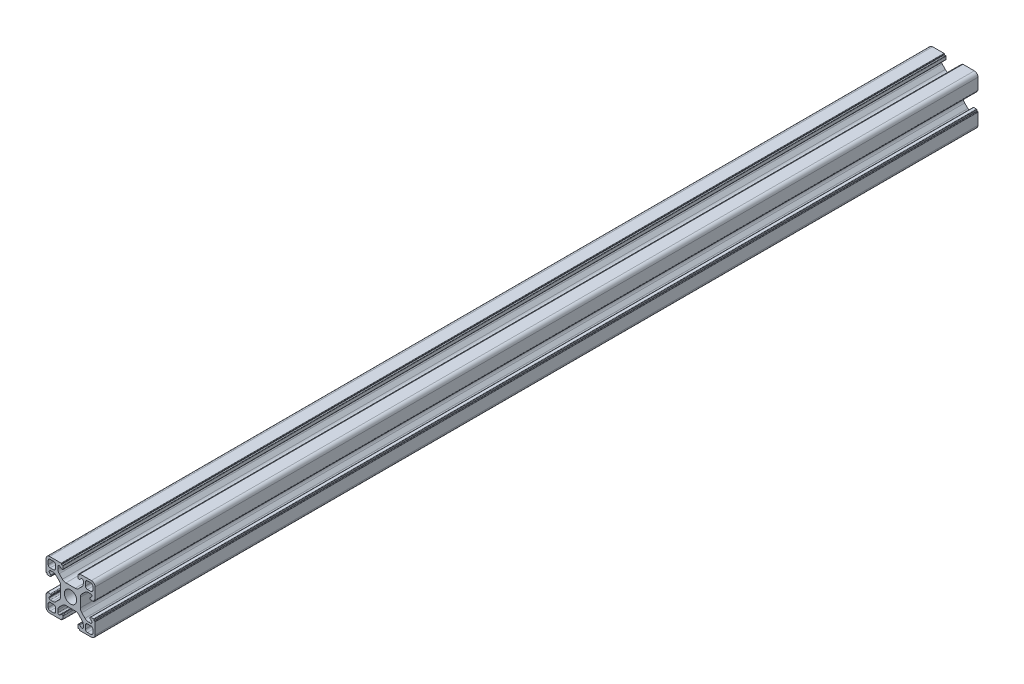
from build123d import *

# Parameters (mm, degrees)
EXTRUDE_1_DEPTH = 360


with BuildPart() as part:
    # Эскиз1 → Бобышка-Вытянуть1 (new body)
    with BuildSketch(Plane.XY):
        with BuildLine():
            Line((-31.105150957, 65.209647948), (-29.206370287, 65.209647948))
            ThreePointArc((-29.206370287, 65.209647948), (-28.441003423, 65.361888883), (-27.792156725, 65.795434385))
            Line((-27.792156725, 65.795434385), (-26.490937394, 67.096653716))
            ThreePointArc((-26.490937394, 67.096653716), (-26.057391892, 67.745500414), (-25.905150957, 68.510867279))
            Line((-25.905150957, 68.510867279), (-25.905150957, 69.409647948))
            ThreePointArc((-25.905150957, 69.409647948), (-26.051597566, 69.763201338), (-26.405150957, 69.909647948))
            Line((-26.405150957, 69.909647948), (-26.508044175, 69.909647948))
            ThreePointArc((-26.508044175, 69.909647948), (-26.699385892, 69.871587714), (-26.861597566, 69.763201338))
            Line((-26.861597566, 69.763201338), (-27.341927652, 69.282871252))
            ThreePointArc((-27.341927652, 69.282871252), (-27.423033489, 69.228678065), (-27.518704347, 69.209647948))
            Line((-27.518704347, 69.209647948), (-27.805150957, 69.209647948))
            ThreePointArc((-27.805150957, 69.209647948), (-27.981927652, 69.282871252), (-28.055150957, 69.459647948))
            Line((-28.055150957, 69.459647948), (-28.055150957, 70.608718768))
            ThreePointArc((-28.055150957, 70.608718768), (-28.011216974, 70.714784785), (-27.905150957, 70.758718768))
            Line((-27.905150957, 70.758718768), (-27.405150957, 70.758718768))
            Line((-27.405150957, 70.758718768), (-27.405150957, 71.059647948))
            ThreePointArc((-27.405150957, 71.059647948), (-27.361216974, 71.165713965), (-27.255150957, 71.209647948))
            Line((-27.255150957, 71.209647948), (-22.605150957, 71.209647948))
            ThreePointArc((-22.605150957, 71.209647948), (-21.544490785, 70.770308119), (-21.105150957, 69.709647948))
            Line((-21.105150957, 69.709647948), (-21.105150957, 65.059647948))
            ThreePointArc((-21.105150957, 65.059647948), (-21.149084939, 64.953581931), (-21.255150957, 64.909647948))
            Line((-21.255150957, 64.909647948), (-21.556080136, 64.909647948))
            Line((-21.556080136, 64.909647948), (-21.556080136, 64.409647948))
            ThreePointArc((-21.556080136, 64.409647948), (-21.600014119, 64.303581931), (-21.706080136, 64.259647948))
            Line((-21.706080136, 64.259647948), (-22.855150957, 64.259647948))
            ThreePointArc((-22.855150957, 64.259647948), (-23.031927652, 64.332871252), (-23.105150957, 64.509647948))
            Line((-23.105150957, 64.509647948), (-23.105150957, 64.796094557))
            ThreePointArc((-23.105150957, 64.796094557), (-23.08612084, 64.891765415), (-23.031927652, 64.972871252))
            Line((-23.031927652, 64.972871252), (-22.551597566, 65.453201338))
            ThreePointArc((-22.551597566, 65.453201338), (-22.44321119, 65.615413013), (-22.405150957, 65.806754729))
            Line((-22.405150957, 65.806754729), (-22.405150957, 65.909647948))
            ThreePointArc((-22.405150957, 65.909647948), (-22.551597566, 66.263201338), (-22.905150957, 66.409647948))
            Line((-22.905150957, 66.409647948), (-23.803931626, 66.409647948))
            ThreePointArc((-23.803931626, 66.409647948), (-24.56929849, 66.257407013), (-25.218145188, 65.82386151))
            Line((-25.218145188, 65.82386151), (-26.519364519, 64.522642179))
            ThreePointArc((-26.519364519, 64.522642179), (-26.952910022, 63.873795482), (-27.105150957, 63.108428617))
            Line((-27.105150957, 63.108428617), (-27.105150957, 61.209647948))
            Line((-27.105150957, 61.209647948), (-27.105150957, 59.310867279))
            ThreePointArc((-27.105150957, 59.310867279), (-26.952910022, 58.545500414), (-26.519364519, 57.896653716))
            Line((-26.519364519, 57.896653716), (-25.218145188, 56.595434385))
            ThreePointArc((-25.218145188, 56.595434385), (-24.56929849, 56.161888883), (-23.803931626, 56.009647948))
            Line((-23.803931626, 56.009647948), (-22.905150957, 56.009647948))
            ThreePointArc((-22.905150957, 56.009647948), (-22.551597566, 56.156094557), (-22.405150957, 56.509647948))
            Line((-22.405150957, 56.509647948), (-22.405150957, 56.612541166))
            ThreePointArc((-22.405150957, 56.612541166), (-22.44321119, 56.803882883), (-22.551597566, 56.966094557))
            Line((-22.551597566, 56.966094557), (-23.031927652, 57.446424643))
            ThreePointArc((-23.031927652, 57.446424643), (-23.08612084, 57.52753048), (-23.105150957, 57.623201338))
            Line((-23.105150957, 57.623201338), (-23.105150957, 57.909647948))
            ThreePointArc((-23.105150957, 57.909647948), (-23.031927652, 58.086424643), (-22.855150957, 58.159647948))
            Line((-22.855150957, 58.159647948), (-21.706080136, 58.159647948))
            ThreePointArc((-21.706080136, 58.159647948), (-21.600014119, 58.115713965), (-21.556080136, 58.009647948))
            Line((-21.556080136, 58.009647948), (-21.556080136, 57.509647948))
            Line((-21.556080136, 57.509647948), (-21.255150957, 57.509647948))
            ThreePointArc((-21.255150957, 57.509647948), (-21.149084939, 57.465713965), (-21.105150957, 57.359647948))
            Line((-21.105150957, 57.359647948), (-21.105150957, 52.709647948))
            ThreePointArc((-21.105150957, 52.709647948), (-21.544490785, 51.648987776), (-22.605150957, 51.209647948))
            Line((-22.605150957, 51.209647948), (-27.255150957, 51.209647948))
            ThreePointArc((-27.255150957, 51.209647948), (-27.361216974, 51.253581931), (-27.405150957, 51.359647948))
            Line((-27.405150957, 51.359647948), (-27.405150957, 51.660577127))
            Line((-27.405150957, 51.660577127), (-27.905150957, 51.660577127))
            ThreePointArc((-27.905150957, 51.660577127), (-28.011216974, 51.70451111), (-28.055150957, 51.810577127))
            Line((-28.055150957, 51.810577127), (-28.055150957, 52.959647948))
            ThreePointArc((-28.055150957, 52.959647948), (-27.981927652, 53.136424643), (-27.805150957, 53.209647948))
            Line((-27.805150957, 53.209647948), (-27.518704347, 53.209647948))
            ThreePointArc((-27.518704347, 53.209647948), (-27.423033489, 53.190617831), (-27.341927652, 53.136424643))
            Line((-27.341927652, 53.136424643), (-26.861597566, 52.656094557))
            ThreePointArc((-26.861597566, 52.656094557), (-26.699385892, 52.547708181), (-26.508044175, 52.509647948))
            Line((-26.508044175, 52.509647948), (-26.405150957, 52.509647948))
            ThreePointArc((-26.405150957, 52.509647948), (-26.051597566, 52.656094557), (-25.905150957, 53.009647948))
            Line((-25.905150957, 53.009647948), (-25.905150957, 53.908428617))
            ThreePointArc((-25.905150957, 53.908428617), (-26.057391892, 54.673795482), (-26.490937394, 55.322642179))
            Line((-26.490937394, 55.322642179), (-27.792156725, 56.62386151))
            ThreePointArc((-27.792156725, 56.62386151), (-28.441003423, 57.057407013), (-29.206370287, 57.209647948))
            Line((-29.206370287, 57.209647948), (-31.105150957, 57.209647948))
            Line((-31.105150957, 57.209647948), (-33.003931626, 57.209647948))
            ThreePointArc((-33.003931626, 57.209647948), (-33.76929849, 57.057407013), (-34.418145188, 56.62386151))
            Line((-34.418145188, 56.62386151), (-35.719364519, 55.322642179))
            ThreePointArc((-35.719364519, 55.322642179), (-36.152910022, 54.673795482), (-36.305150957, 53.908428617))
            Line((-36.305150957, 53.908428617), (-36.305150957, 53.009647948))
            ThreePointArc((-36.305150957, 53.009647948), (-36.158704347, 52.656094557), (-35.805150957, 52.509647948))
            Line((-35.805150957, 52.509647948), (-35.702257738, 52.509647948))
            ThreePointArc((-35.702257738, 52.509647948), (-35.510916022, 52.547708181), (-35.348704347, 52.656094557))
            Line((-35.348704347, 52.656094557), (-34.868374261, 53.136424643))
            ThreePointArc((-34.868374261, 53.136424643), (-34.787268424, 53.190617831), (-34.691597566, 53.209647948))
            Line((-34.691597566, 53.209647948), (-34.405150957, 53.209647948))
            ThreePointArc((-34.405150957, 53.209647948), (-34.228374261, 53.136424643), (-34.155150957, 52.959647948))
            Line((-34.155150957, 52.959647948), (-34.155150957, 51.810577127))
            ThreePointArc((-34.155150957, 51.810577127), (-34.199084939, 51.70451111), (-34.305150957, 51.660577127))
            Line((-34.305150957, 51.660577127), (-34.805150957, 51.660577127))
            Line((-34.805150957, 51.660577127), (-34.805150957, 51.359647948))
            ThreePointArc((-34.805150957, 51.359647948), (-34.849084939, 51.253581931), (-34.955150957, 51.209647948))
            Line((-34.955150957, 51.209647948), (-39.605150957, 51.209647948))
            ThreePointArc((-39.605150957, 51.209647948), (-40.665811128, 51.648987776), (-41.105150957, 52.709647948))
            Line((-41.105150957, 52.709647948), (-41.105150957, 57.359647948))
            ThreePointArc((-41.105150957, 57.359647948), (-41.061216974, 57.465713965), (-40.955150957, 57.509647948))
            Line((-40.955150957, 57.509647948), (-40.654221777, 57.509647948))
            Line((-40.654221777, 57.509647948), (-40.654221777, 58.009647948))
            ThreePointArc((-40.654221777, 58.009647948), (-40.610287794, 58.115713965), (-40.504221777, 58.159647948))
            Line((-40.504221777, 58.159647948), (-39.355150957, 58.159647948))
            ThreePointArc((-39.355150957, 58.159647948), (-39.178374261, 58.086424643), (-39.105150957, 57.909647948))
            Line((-39.105150957, 57.909647948), (-39.105150957, 57.623201338))
            ThreePointArc((-39.105150957, 57.623201338), (-39.124181073, 57.52753048), (-39.178374261, 57.446424643))
            Line((-39.178374261, 57.446424643), (-39.658704347, 56.966094557))
            ThreePointArc((-39.658704347, 56.966094557), (-39.767090723, 56.803882883), (-39.805150957, 56.612541166))
            Line((-39.805150957, 56.612541166), (-39.805150957, 56.509647948))
            ThreePointArc((-39.805150957, 56.509647948), (-39.658704347, 56.156094557), (-39.305150957, 56.009647948))
            Line((-39.305150957, 56.009647948), (-38.406370287, 56.009647948))
            ThreePointArc((-38.406370287, 56.009647948), (-37.641003423, 56.161888883), (-36.992156725, 56.595434385))
            Line((-36.992156725, 56.595434385), (-35.690937394, 57.896653716))
            ThreePointArc((-35.690937394, 57.896653716), (-35.257391892, 58.545500414), (-35.105150957, 59.310867279))
            Line((-35.105150957, 59.310867279), (-35.105150957, 61.209647948))
            Line((-35.105150957, 61.209647948), (-35.105150957, 63.108428617))
            ThreePointArc((-35.105150957, 63.108428617), (-35.257391892, 63.873795482), (-35.690937394, 64.522642179))
            Line((-35.690937394, 64.522642179), (-36.992156725, 65.82386151))
            ThreePointArc((-36.992156725, 65.82386151), (-37.641003423, 66.257407013), (-38.406370287, 66.409647948))
            Line((-38.406370287, 66.409647948), (-39.305150957, 66.409647948))
            ThreePointArc((-39.305150957, 66.409647948), (-39.658704347, 66.263201338), (-39.805150957, 65.909647948))
            Line((-39.805150957, 65.909647948), (-39.805150957, 65.806754729))
            ThreePointArc((-39.805150957, 65.806754729), (-39.767090723, 65.615413013), (-39.658704347, 65.453201338))
            Line((-39.658704347, 65.453201338), (-39.178374261, 64.972871252))
            ThreePointArc((-39.178374261, 64.972871252), (-39.124181073, 64.891765415), (-39.105150957, 64.796094557))
            Line((-39.105150957, 64.796094557), (-39.105150957, 64.509647948))
            ThreePointArc((-39.105150957, 64.509647948), (-39.178374261, 64.332871252), (-39.355150957, 64.259647948))
            Line((-39.355150957, 64.259647948), (-40.504221777, 64.259647948))
            ThreePointArc((-40.504221777, 64.259647948), (-40.610287794, 64.303581931), (-40.654221777, 64.409647948))
            Line((-40.654221777, 64.409647948), (-40.654221777, 64.909647948))
            Line((-40.654221777, 64.909647948), (-40.955150957, 64.909647948))
            ThreePointArc((-40.955150957, 64.909647948), (-41.061216974, 64.953581931), (-41.105150957, 65.059647948))
            Line((-41.105150957, 65.059647948), (-41.105150957, 69.709647948))
            ThreePointArc((-41.105150957, 69.709647948), (-40.665811128, 70.770308119), (-39.605150957, 71.209647948))
            Line((-39.605150957, 71.209647948), (-34.955150957, 71.209647948))
            ThreePointArc((-34.955150957, 71.209647948), (-34.849084939, 71.165713965), (-34.805150957, 71.059647948))
            Line((-34.805150957, 71.059647948), (-34.805150957, 70.758718768))
            Line((-34.805150957, 70.758718768), (-34.305150957, 70.758718768))
            ThreePointArc((-34.305150957, 70.758718768), (-34.199084939, 70.714784785), (-34.155150957, 70.608718768))
            Line((-34.155150957, 70.608718768), (-34.155150957, 69.459647948))
            ThreePointArc((-34.155150957, 69.459647948), (-34.228374261, 69.282871252), (-34.405150957, 69.209647948))
            Line((-34.405150957, 69.209647948), (-34.691597566, 69.209647948))
            ThreePointArc((-34.691597566, 69.209647948), (-34.787268424, 69.228678065), (-34.868374261, 69.282871252))
            Line((-34.868374261, 69.282871252), (-35.348704347, 69.763201338))
            ThreePointArc((-35.348704347, 69.763201338), (-35.510916022, 69.871587714), (-35.702257738, 69.909647948))
            Line((-35.702257738, 69.909647948), (-35.805150957, 69.909647948))
            ThreePointArc((-35.805150957, 69.909647948), (-36.158704347, 69.763201338), (-36.305150957, 69.409647948))
            Line((-36.305150957, 69.409647948), (-36.305150957, 68.510867279))
            ThreePointArc((-36.305150957, 68.510867279), (-36.152910022, 67.745500414), (-35.719364519, 67.096653716))
            Line((-35.719364519, 67.096653716), (-34.418145188, 65.795434385))
            ThreePointArc((-34.418145188, 65.795434385), (-33.76929849, 65.361888883), (-33.003931626, 65.209647948))
            Line((-33.003931626, 65.209647948), (-31.105150957, 65.209647948))
        make_face()
        with BuildLine():
            Line((-24.205150957, 67.309647948), (-22.805150957, 67.309647948))
            ThreePointArc((-22.805150957, 67.309647948), (-22.239465532, 67.543962523), (-22.005150957, 68.109647948))
            Line((-22.005150957, 68.109647948), (-22.005150957, 69.509647948))
            ThreePointArc((-22.005150957, 69.509647948), (-22.239465532, 70.075333373), (-22.805150957, 70.309647948))
            Line((-22.805150957, 70.309647948), (-24.205150957, 70.309647948))
            ThreePointArc((-24.205150957, 70.309647948), (-24.770836381, 70.075333373), (-25.005150957, 69.509647948))
            Line((-25.005150957, 69.509647948), (-25.005150957, 68.109647948))
            ThreePointArc((-25.005150957, 68.109647948), (-24.770836381, 67.543962523), (-24.205150957, 67.309647948))
        make_face(mode=Mode.SUBTRACT)
        with BuildLine():
            Line((-25.005150957, 54.309647948), (-25.005150957, 52.909647948))
            ThreePointArc((-25.005150957, 52.909647948), (-24.770836381, 52.343962523), (-24.205150957, 52.109647948))
            Line((-24.205150957, 52.109647948), (-22.805150957, 52.109647948))
            ThreePointArc((-22.805150957, 52.109647948), (-22.239465532, 52.343962523), (-22.005150957, 52.909647948))
            Line((-22.005150957, 52.909647948), (-22.005150957, 54.309647948))
            ThreePointArc((-22.005150957, 54.309647948), (-22.239465532, 54.875333373), (-22.805150957, 55.109647948))
            Line((-22.805150957, 55.109647948), (-24.205150957, 55.109647948))
            ThreePointArc((-24.205150957, 55.109647948), (-24.770836381, 54.875333373), (-25.005150957, 54.309647948))
        make_face(mode=Mode.SUBTRACT)
        with BuildLine():
            Line((-38.005150957, 55.109647948), (-39.405150957, 55.109647948))
            ThreePointArc((-39.405150957, 55.109647948), (-39.970836381, 54.875333373), (-40.205150957, 54.309647948))
            Line((-40.205150957, 54.309647948), (-40.205150957, 52.909647948))
            ThreePointArc((-40.205150957, 52.909647948), (-39.970836381, 52.343962523), (-39.405150957, 52.109647948))
            Line((-39.405150957, 52.109647948), (-38.005150957, 52.109647948))
            ThreePointArc((-38.005150957, 52.109647948), (-37.439465532, 52.343962523), (-37.205150957, 52.909647948))
            Line((-37.205150957, 52.909647948), (-37.205150957, 54.309647948))
            ThreePointArc((-37.205150957, 54.309647948), (-37.439465532, 54.875333373), (-38.005150957, 55.109647948))
        make_face(mode=Mode.SUBTRACT)
        with BuildLine():
            Line((-37.205150957, 68.109647948), (-37.205150957, 69.509647948))
            ThreePointArc((-37.205150957, 69.509647948), (-37.439465532, 70.075333373), (-38.005150957, 70.309647948))
            Line((-38.005150957, 70.309647948), (-39.405150957, 70.309647948))
            ThreePointArc((-39.405150957, 70.309647948), (-39.970836381, 70.075333373), (-40.205150957, 69.509647948))
            Line((-40.205150957, 69.509647948), (-40.205150957, 68.109647948))
            ThreePointArc((-40.205150957, 68.109647948), (-39.970836381, 67.543962523), (-39.405150957, 67.309647948))
            Line((-39.405150957, 67.309647948), (-38.005150957, 67.309647948))
            ThreePointArc((-38.005150957, 67.309647948), (-37.439465532, 67.543962523), (-37.205150957, 68.109647948))
        make_face(mode=Mode.SUBTRACT)
        with BuildLine():
            ThreePointArc((-28.605150957, 61.209647948), (-29.337384004, 62.977414901), (-31.105150957, 63.709647948))
            ThreePointArc((-31.105150957, 63.709647948), (-32.87291791, 62.977414901), (-33.605150957, 61.209647948))
            ThreePointArc((-33.605150957, 61.209647948), (-32.87291791, 59.441880995), (-31.105150957, 58.709647948))
            ThreePointArc((-31.105150957, 58.709647948), (-29.337384004, 59.441880995), (-28.605150957, 61.209647948))
        make_face(mode=Mode.SUBTRACT)
    extrude(amount=EXTRUDE_1_DEPTH)


solid = part.part
